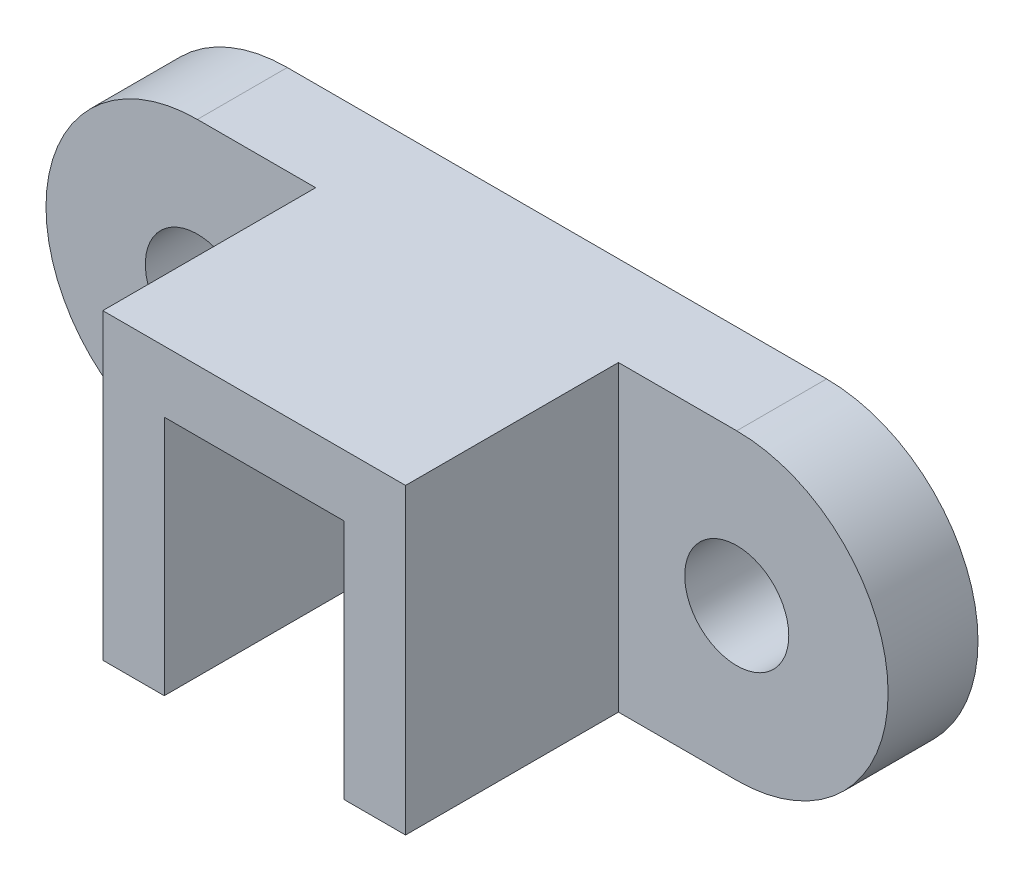
from build123d import *

# Parameters (mm, degrees)
SKETCH1_R           = 11
BOSS_EXTRUDE1_DEPTH = 19
SKETCH3_W           = 64
SKETCH3_H           = 64
BOSS_EXTRUDE2_DEPTH = 45
CUT_EXTRUDE1_START  = -13
CUT_EXTRUDE1_DEPTH  = 38


with BuildPart() as part:
    # Sketch1 → Boss-Extrude1 (new body)
    with BuildSketch(Plane.XY):
        with BuildLine():
            Line((0, -32), (-114, -32))
            ThreePointArc((-114, -32), (-146, 0), (-114, 32))
            Line((-114, 32), (0, 32))
            ThreePointArc((0, 32), (32, 0), (0, -32))
        make_face()
        with Locations((-114, 0)):
            Circle(SKETCH1_R, mode=Mode.SUBTRACT)
        Circle(SKETCH1_R, mode=Mode.SUBTRACT)
    extrude(amount=BOSS_EXTRUDE1_DEPTH)

    # Sketch3 → Boss-Extrude2 (add)
    with BuildSketch(Plane.XY.offset(19)):
        with Locations((-57, 0)):
            Rectangle(SKETCH3_W, SKETCH3_H)
    extrude(amount=BOSS_EXTRUDE2_DEPTH)

    # Sketch7 → Cut-Extrude1 (cut)
    with BuildSketch(Plane.ZY.offset(89).offset(CUT_EXTRUDE1_START)):
        Polygon((64, -32), (64, 19), (13, -32), align=None)
    extrude(amount=-CUT_EXTRUDE1_DEPTH, mode=Mode.SUBTRACT)


solid = part.part
